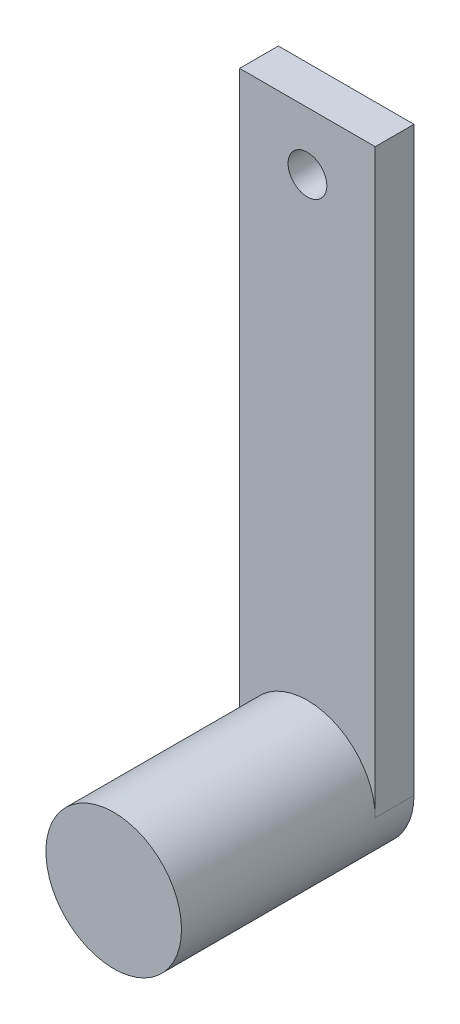
from build123d import *

# Parameters (mm, degrees)
SKETCH1_R           = 3.5
BOSS_EXTRUDE1_DEPTH = 10
BOSS_EXTRUDE2_START = 2
SKETCH2_R           = 1
BOSS_EXTRUDE2_DEPTH = 2


with BuildPart() as part:
    # Sketch1 → Boss-Extrude1 (new body)
    with BuildSketch(Plane.XY):
        Circle(SKETCH1_R)
    extrude(amount=BOSS_EXTRUDE1_DEPTH)

    # Sketch2 → Boss-Extrude2 (add)
    with BuildSketch(Plane(origin=(0, 0, 0), x_dir=(-1, 0, 0), z_dir=(0, 0, -1)).offset(BOSS_EXTRUDE2_START)):
        with BuildLine():
            Line((-3.5, 0), (-3.5, 30))
            Line((-3.5, 30), (3.5, 30))
            Line((3.5, 30), (3.5, 0))
            ThreePointArc((3.5, 0), (0, -3.5), (-3.5, 0))
        make_face()
        with Locations((0, 27)):
            Circle(SKETCH2_R, mode=Mode.SUBTRACT)
    extrude(amount=-BOSS_EXTRUDE2_DEPTH)


solid = part.part
